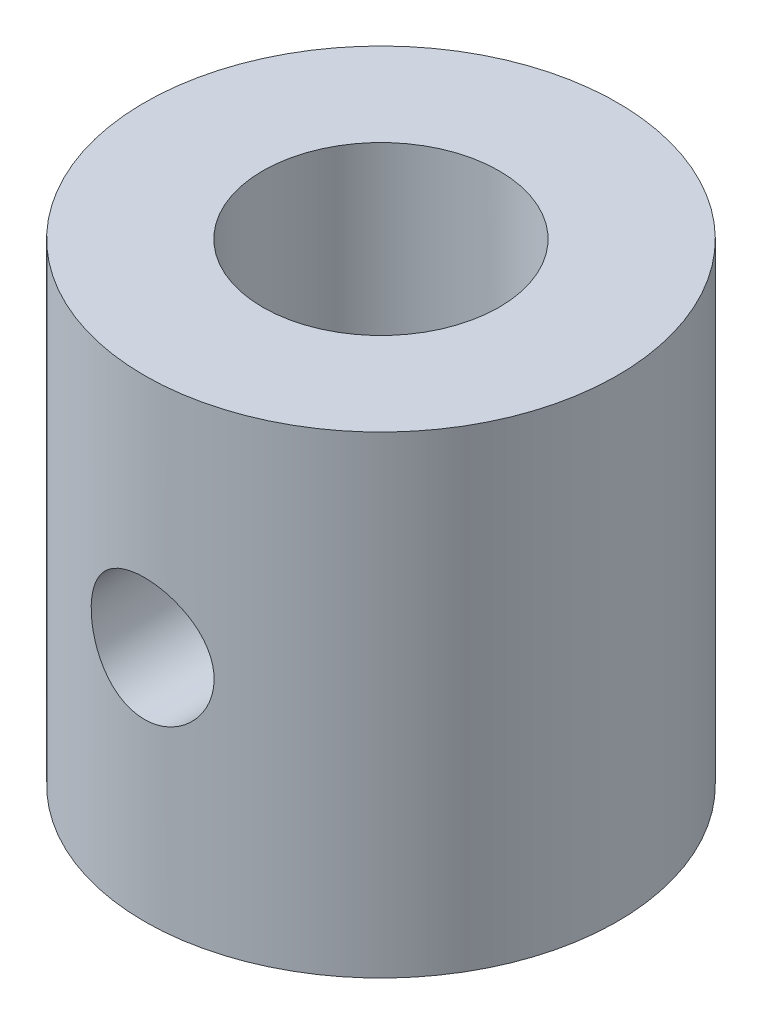
from build123d import *

# Parameters (mm, degrees)
SKETCH1_R            = 5
SKETCH1_R_2          = 2.5
BOSS_EXTRUDE1_DEPTH  = 10
M2_CLEARANCE_HOLE1_D = 2.6


with BuildPart() as part:
    # Sketch1 → Boss-Extrude1 (new body)
    with BuildSketch(Plane(origin=(0, 0, 0), x_dir=(1, 0, 0), z_dir=(0, 1, 0))):
        with Locations(Location((0, 0, 0), (0, 0, 270))):
            Circle(SKETCH1_R)
        with Locations(Location((0, 0, 0), (0, 0, 270))):
            Circle(SKETCH1_R_2, mode=Mode.SUBTRACT)
    extrude(amount=BOSS_EXTRUDE1_DEPTH)

    # M2 Clearance Hole1 (through all)
    with Locations(Plane.XY.offset(5)):
        with Locations((0, 5)):
            Hole(M2_CLEARANCE_HOLE1_D / 2)


solid = part.part
